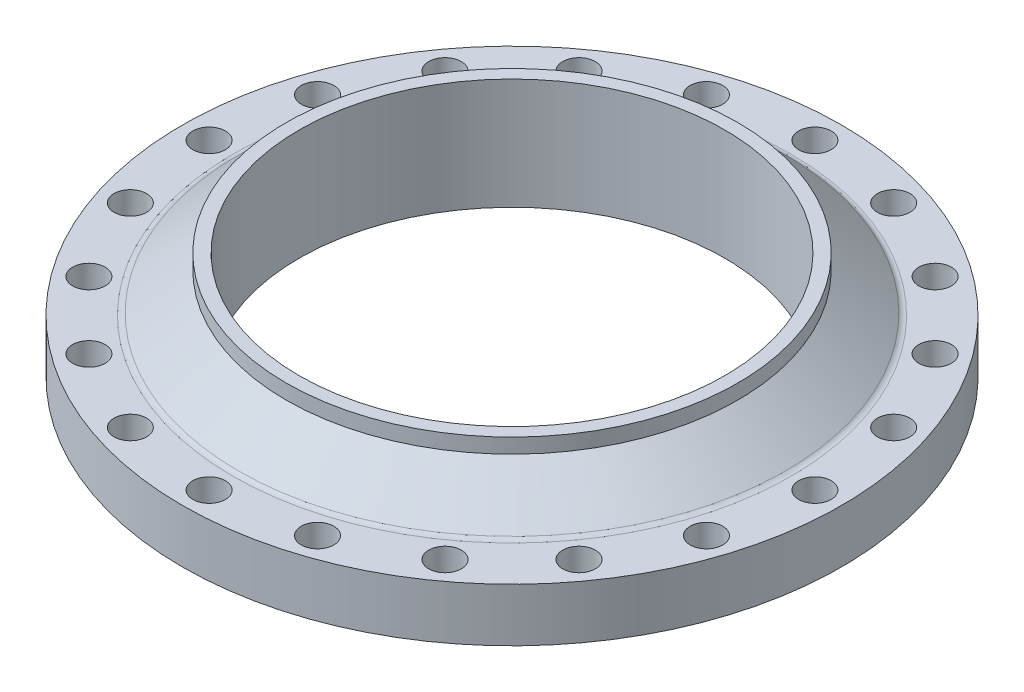
from build123d import *

# Parameters (mm, degrees)
CUT_EXTRUDE1_REACH = 647.813
SKETCH2_R          = 22


with BuildPart() as part:
    # Sketch1 → Revolve1 (revolve)
    with BuildSketch(Plane.XY, mode=Mode.PRIVATE) as revolve1_sk:
        with BuildLine():
            Line((287.4, 150), (287.4, 0))
            Line((287.4, 0), (370, 0))
            Line((370, 0), (375, 5))
            Line((375, 5), (445, 5))
            Line((445, 5), (445, 77))
            Line((445, 77), (376.768837866, 77))
            ThreePointArc((376.768837866, 77), (372.862020012, 77.653777093), (369.380900162, 79.543870957))
            Line((369.380900162, 79.543870957), (304.8, 130))
            Line((304.8, 130), (304.8, 150))
            Line((304.8, 150), (287.4, 150))
        make_face()
    revolve(revolve1_sk.sketch.rotate(Axis((0, 163.859738806, 0), (0, -1, 0)), 90), axis=Axis((0, 163.859738806, 0), (0, -1, 0)))

    # Sketch2 → Cut-Extrude1 (cut, up to next)
    with BuildSketch(Plane.XZ.offset(-5), mode=Mode.PRIVATE) as cut_extrude1_sk1:
        with Locations(Location((0, 409, 0), (0, 0, 270))):
            Circle(SKETCH2_R)
    cut_extrude1_tool1 = extrude(cut_extrude1_sk1.sketch, amount=-CUT_EXTRUDE1_REACH, mode=Mode.PRIVATE) & part.part
    # Sketch2 → Cut-Extrude1 (cut, up to next)
    with BuildSketch(Plane.XZ.offset(-5), mode=Mode.PRIVATE) as cut_extrude1_sk2:
        with Locations(Location((126.387950699, 388.982115165, 0), (0, 0, 270))):
            Circle(SKETCH2_R)
    cut_extrude1_tool2 = extrude(cut_extrude1_sk2.sketch, amount=-CUT_EXTRUDE1_REACH, mode=Mode.PRIVATE) & part.part
    # Sketch2 → Cut-Extrude1 (cut, up to next)
    with BuildSketch(Plane.XZ.offset(-5), mode=Mode.PRIVATE) as cut_extrude1_sk3:
        with Locations(Location((240.404168188, 330.887950699, 0), (0, 0, 270))):
            Circle(SKETCH2_R)
    cut_extrude1_tool3 = extrude(cut_extrude1_sk3.sketch, amount=-CUT_EXTRUDE1_REACH, mode=Mode.PRIVATE) & part.part
    # Sketch2 → Cut-Extrude1 (cut, up to next)
    with BuildSketch(Plane.XZ.offset(-5), mode=Mode.PRIVATE) as cut_extrude1_sk4:
        with Locations(Location((330.887950699, 240.404168188, 0), (0, 0, 270))):
            Circle(SKETCH2_R)
    cut_extrude1_tool4 = extrude(cut_extrude1_sk4.sketch, amount=-CUT_EXTRUDE1_REACH, mode=Mode.PRIVATE) & part.part
    # Sketch2 → Cut-Extrude1 (cut, up to next)
    with BuildSketch(Plane.XZ.offset(-5), mode=Mode.PRIVATE) as cut_extrude1_sk5:
        with Locations(Location((388.982115165, 126.387950699, 0), (0, 0, 270))):
            Circle(SKETCH2_R)
    cut_extrude1_tool5 = extrude(cut_extrude1_sk5.sketch, amount=-CUT_EXTRUDE1_REACH, mode=Mode.PRIVATE) & part.part
    # Sketch2 → Cut-Extrude1 (cut, up to next)
    with BuildSketch(Plane.XZ.offset(-5), mode=Mode.PRIVATE) as cut_extrude1_sk6:
        with Locations(Location((409, 0, 0), (0, 0, 270))):
            Circle(SKETCH2_R)
    cut_extrude1_tool6 = extrude(cut_extrude1_sk6.sketch, amount=-CUT_EXTRUDE1_REACH, mode=Mode.PRIVATE) & part.part
    # Sketch2 → Cut-Extrude1 (cut, up to next)
    with BuildSketch(Plane.XZ.offset(-5), mode=Mode.PRIVATE) as cut_extrude1_sk7:
        with Locations(Location((388.982115165, -126.387950699, 0), (0, 0, 270))):
            Circle(SKETCH2_R)
    cut_extrude1_tool7 = extrude(cut_extrude1_sk7.sketch, amount=-CUT_EXTRUDE1_REACH, mode=Mode.PRIVATE) & part.part
    # Sketch2 → Cut-Extrude1 (cut, up to next)
    with BuildSketch(Plane.XZ.offset(-5), mode=Mode.PRIVATE) as cut_extrude1_sk8:
        with Locations(Location((330.887950699, -240.404168188, 0), (0, 0, 270))):
            Circle(SKETCH2_R)
    cut_extrude1_tool8 = extrude(cut_extrude1_sk8.sketch, amount=-CUT_EXTRUDE1_REACH, mode=Mode.PRIVATE) & part.part
    # Sketch2 → Cut-Extrude1 (cut, up to next)
    with BuildSketch(Plane.XZ.offset(-5), mode=Mode.PRIVATE) as cut_extrude1_sk9:
        with Locations(Location((240.404168188, -330.887950699, 0), (0, 0, 270))):
            Circle(SKETCH2_R)
    cut_extrude1_tool9 = extrude(cut_extrude1_sk9.sketch, amount=-CUT_EXTRUDE1_REACH, mode=Mode.PRIVATE) & part.part
    # Sketch2 → Cut-Extrude1 (cut, up to next)
    with BuildSketch(Plane.XZ.offset(-5), mode=Mode.PRIVATE) as cut_extrude1_sk10:
        with Locations(Location((126.387950699, -388.982115165, 0), (0, 0, 270))):
            Circle(SKETCH2_R)
    cut_extrude1_tool10 = extrude(cut_extrude1_sk10.sketch, amount=-CUT_EXTRUDE1_REACH, mode=Mode.PRIVATE) & part.part
    # Sketch2 → Cut-Extrude1 (cut, up to next)
    with BuildSketch(Plane.XZ.offset(-5), mode=Mode.PRIVATE) as cut_extrude1_sk11:
        with Locations(Location((0, -409, 0), (0, 0, 270))):
            Circle(SKETCH2_R)
    cut_extrude1_tool11 = extrude(cut_extrude1_sk11.sketch, amount=-CUT_EXTRUDE1_REACH, mode=Mode.PRIVATE) & part.part
    # Sketch2 → Cut-Extrude1 (cut, up to next)
    with BuildSketch(Plane.XZ.offset(-5), mode=Mode.PRIVATE) as cut_extrude1_sk12:
        with Locations(Location((-126.387950699, -388.982115165, 0), (0, 0, 270))):
            Circle(SKETCH2_R)
    cut_extrude1_tool12 = extrude(cut_extrude1_sk12.sketch, amount=-CUT_EXTRUDE1_REACH, mode=Mode.PRIVATE) & part.part
    # Sketch2 → Cut-Extrude1 (cut, up to next)
    with BuildSketch(Plane.XZ.offset(-5), mode=Mode.PRIVATE) as cut_extrude1_sk13:
        with Locations(Location((-240.404168188, -330.887950699, 0), (0, 0, 270))):
            Circle(SKETCH2_R)
    cut_extrude1_tool13 = extrude(cut_extrude1_sk13.sketch, amount=-CUT_EXTRUDE1_REACH, mode=Mode.PRIVATE) & part.part
    # Sketch2 → Cut-Extrude1 (cut, up to next)
    with BuildSketch(Plane.XZ.offset(-5), mode=Mode.PRIVATE) as cut_extrude1_sk14:
        with Locations(Location((-330.887950699, -240.404168188, 0), (0, 0, 270))):
            Circle(SKETCH2_R)
    cut_extrude1_tool14 = extrude(cut_extrude1_sk14.sketch, amount=-CUT_EXTRUDE1_REACH, mode=Mode.PRIVATE) & part.part
    # Sketch2 → Cut-Extrude1 (cut, up to next)
    with BuildSketch(Plane.XZ.offset(-5), mode=Mode.PRIVATE) as cut_extrude1_sk15:
        with Locations(Location((-388.982115165, -126.387950699, 0), (0, 0, 270))):
            Circle(SKETCH2_R)
    cut_extrude1_tool15 = extrude(cut_extrude1_sk15.sketch, amount=-CUT_EXTRUDE1_REACH, mode=Mode.PRIVATE) & part.part
    # Sketch2 → Cut-Extrude1 (cut, up to next)
    with BuildSketch(Plane.XZ.offset(-5), mode=Mode.PRIVATE) as cut_extrude1_sk16:
        with Locations(Location((-409, 0, 0), (0, 0, 270))):
            Circle(SKETCH2_R)
    cut_extrude1_tool16 = extrude(cut_extrude1_sk16.sketch, amount=-CUT_EXTRUDE1_REACH, mode=Mode.PRIVATE) & part.part
    # Sketch2 → Cut-Extrude1 (cut, up to next)
    with BuildSketch(Plane.XZ.offset(-5), mode=Mode.PRIVATE) as cut_extrude1_sk17:
        with Locations(Location((-388.982115165, 126.387950699, 0), (0, 0, 270))):
            Circle(SKETCH2_R)
    cut_extrude1_tool17 = extrude(cut_extrude1_sk17.sketch, amount=-CUT_EXTRUDE1_REACH, mode=Mode.PRIVATE) & part.part
    # Sketch2 → Cut-Extrude1 (cut, up to next)
    with BuildSketch(Plane.XZ.offset(-5), mode=Mode.PRIVATE) as cut_extrude1_sk18:
        with Locations(Location((-330.887950699, 240.404168188, 0), (0, 0, 270))):
            Circle(SKETCH2_R)
    cut_extrude1_tool18 = extrude(cut_extrude1_sk18.sketch, amount=-CUT_EXTRUDE1_REACH, mode=Mode.PRIVATE) & part.part
    # Sketch2 → Cut-Extrude1 (cut, up to next)
    with BuildSketch(Plane.XZ.offset(-5), mode=Mode.PRIVATE) as cut_extrude1_sk19:
        with Locations(Location((-240.404168188, 330.887950699, 0), (0, 0, 270))):
            Circle(SKETCH2_R)
    cut_extrude1_tool19 = extrude(cut_extrude1_sk19.sketch, amount=-CUT_EXTRUDE1_REACH, mode=Mode.PRIVATE) & part.part
    # Sketch2 → Cut-Extrude1 (cut, up to next)
    with BuildSketch(Plane.XZ.offset(-5), mode=Mode.PRIVATE) as cut_extrude1_sk20:
        with Locations(Location((-126.387950699, 388.982115165, 0), (0, 0, 270))):
            Circle(SKETCH2_R)
    cut_extrude1_tool20 = extrude(cut_extrude1_sk20.sketch, amount=-CUT_EXTRUDE1_REACH, mode=Mode.PRIVATE) & part.part
    add(cut_extrude1_tool1.solids().sort_by_distance((0, 5, 409))[0], mode=Mode.SUBTRACT)
    add(cut_extrude1_tool2.solids().sort_by_distance((126.387951, 5, 388.982115))[0], mode=Mode.SUBTRACT)
    add(cut_extrude1_tool3.solids().sort_by_distance((240.404168, 5, 330.887951))[0], mode=Mode.SUBTRACT)
    add(cut_extrude1_tool4.solids().sort_by_distance((330.887951, 5, 240.404168))[0], mode=Mode.SUBTRACT)
    add(cut_extrude1_tool5.solids().sort_by_distance((388.982115, 5, 126.387951))[0], mode=Mode.SUBTRACT)
    add(cut_extrude1_tool6.solids().sort_by_distance((409, 5, 0))[0], mode=Mode.SUBTRACT)
    add(cut_extrude1_tool7.solids().sort_by_distance((388.982115, 5, -126.387951))[0], mode=Mode.SUBTRACT)
    add(cut_extrude1_tool8.solids().sort_by_distance((330.887951, 5, -240.404168))[0], mode=Mode.SUBTRACT)
    add(cut_extrude1_tool9.solids().sort_by_distance((240.404168, 5, -330.887951))[0], mode=Mode.SUBTRACT)
    add(cut_extrude1_tool10.solids().sort_by_distance((126.387951, 5, -388.982115))[0], mode=Mode.SUBTRACT)
    add(cut_extrude1_tool11.solids().sort_by_distance((0, 5, -409))[0], mode=Mode.SUBTRACT)
    add(cut_extrude1_tool12.solids().sort_by_distance((-126.387951, 5, -388.982115))[0], mode=Mode.SUBTRACT)
    add(cut_extrude1_tool13.solids().sort_by_distance((-240.404168, 5, -330.887951))[0], mode=Mode.SUBTRACT)
    add(cut_extrude1_tool14.solids().sort_by_distance((-330.887951, 5, -240.404168))[0], mode=Mode.SUBTRACT)
    add(cut_extrude1_tool15.solids().sort_by_distance((-388.982115, 5, -126.387951))[0], mode=Mode.SUBTRACT)
    add(cut_extrude1_tool16.solids().sort_by_distance((-409, 5, 0))[0], mode=Mode.SUBTRACT)
    add(cut_extrude1_tool17.solids().sort_by_distance((-388.982115, 5, 126.387951))[0], mode=Mode.SUBTRACT)
    add(cut_extrude1_tool18.solids().sort_by_distance((-330.887951, 5, 240.404168))[0], mode=Mode.SUBTRACT)
    add(cut_extrude1_tool19.solids().sort_by_distance((-240.404168, 5, 330.887951))[0], mode=Mode.SUBTRACT)
    add(cut_extrude1_tool20.solids().sort_by_distance((-126.387951, 5, 388.982115))[0], mode=Mode.SUBTRACT)


solid = part.part
